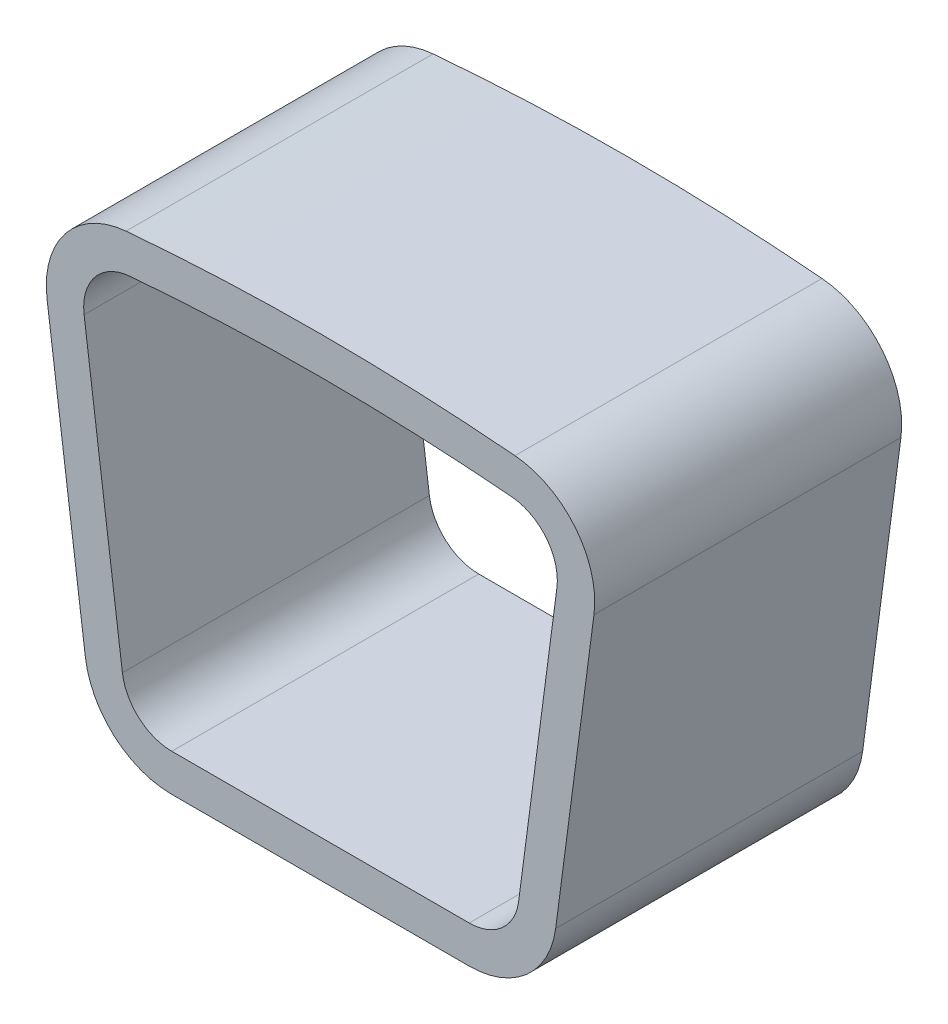
from build123d import *

# Parameters (mm, degrees)
BOSS_EXTRUDE1_DEPTH = 12.325


with BuildPart() as part:
    # Sketch1 → Boss-Extrude1 (new body)
    with BuildSketch(Plane.XY):
        with BuildLine():
            Line((9.441130989, 75.543158327), (10.978710332, 87.222232942))
            ThreePointArc((10.978710332, 87.222232942), (10.23623569, 89.872312951), (7.807292937, 91.166310537))
            ThreePointArc((7.807292937, 91.166310537), (0, 91.5), (-7.807292937, 91.166310537))
            ThreePointArc((-7.807292937, 91.166310537), (-10.23623569, 89.872312951), (-10.978710332, 87.222232942))
            Line((-10.978710332, 87.222232942), (-9.441130989, 75.543158327))
            ThreePointArc((-9.441130989, 75.543158327), (-8.278784327, 73.368560674), (-5.971073974, 72.5))
            Line((-5.971073974, 72.5), (5.971073974, 72.5))
            ThreePointArc((5.971073974, 72.5), (8.278784327, 73.368560674), (9.441130989, 75.543158327))
        make_face()
        with BuildLine():
            Line((-9.49154304, 87.418022231), (-7.953963697, 75.738947616))
            ThreePointArc((-7.953963697, 75.738947616), (-7.289765605, 74.496320385), (-5.971073974, 74))
            Line((-5.971073974, 74), (5.971073974, 74))
            ThreePointArc((5.971073974, 74), (7.289765605, 74.496320385), (7.953963697, 75.738947616))
            Line((7.953963697, 75.738947616), (9.49154304, 87.418022231))
            ThreePointArc((9.49154304, 87.418022231), (9.067271816, 88.932353664), (7.679304529, 89.671780856))
            ThreePointArc((7.679304529, 89.671780856), (0, 90), (-7.679304529, 89.671780856))
            ThreePointArc((-7.679304529, 89.671780856), (-9.067271816, 88.932353664), (-9.49154304, 87.418022231))
        make_face(mode=Mode.SUBTRACT)
    extrude(amount=BOSS_EXTRUDE1_DEPTH)


solid = part.part
